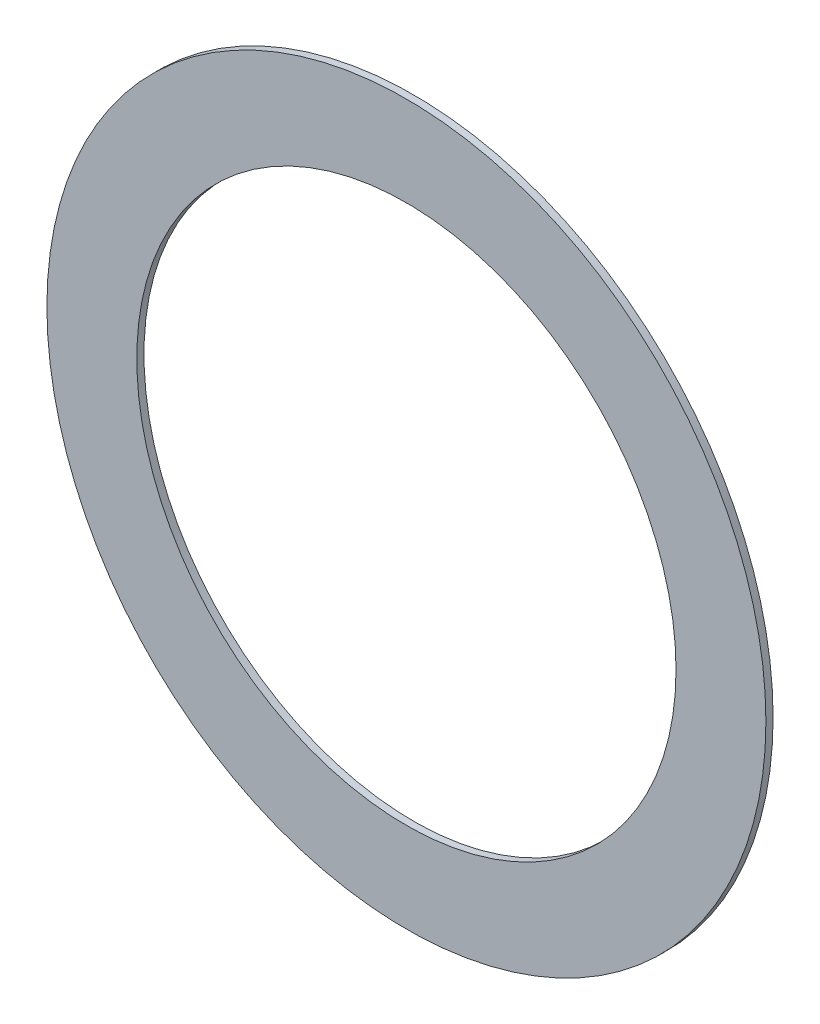
from build123d import *

# Parameters (mm, degrees)
SKETCH1_R           = 50
SKETCH1_R_2         = 37.5
BOSS_EXTRUDE1_DEPTH = 1


with BuildPart() as part:
    # Sketch1 → Boss-Extrude1 (new body)
    with BuildSketch(Plane.XY):
        Circle(SKETCH1_R)
        Circle(SKETCH1_R_2, mode=Mode.SUBTRACT)
    extrude(amount=BOSS_EXTRUDE1_DEPTH)


solid = part.part
